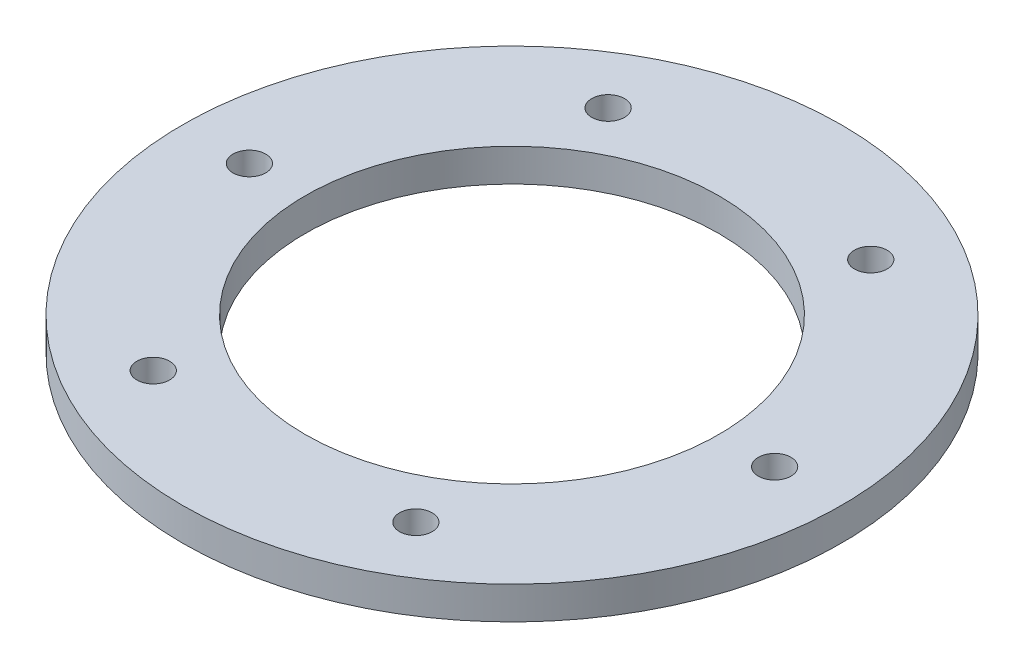
from build123d import *

# Parameters (mm, degrees)
SKETCH_1_W          = 15
SKETCH_1_H          = 4
SKETCH_2_R          = 2
CUT_EXTRUDE_1_DEPTH = 10


with BuildPart() as part:
    # 草图1 → 旋转1 (revolve)
    with BuildSketch(Plane.XY, mode=Mode.PRIVATE) as revolve_1_sk:
        with Locations((32.78, 2)):
            Rectangle(SKETCH_1_W, SKETCH_1_H)
    revolve(revolve_1_sk.sketch.rotate(Axis((0, 0, 0), (0, 1, 0)), 90), axis=Axis((0, 0, 0), (0, 1, 0)))

    # 草图2 → 切除-拉伸1 (cut)
    with BuildSketch(Plane(origin=(0, 4, 0), x_dir=(1, 0, 0), z_dir=(0, 1, 0))):
        with Locations(Location((-32.1, 0, 0), (0, 0, 270))):
            Circle(SKETCH_2_R)
        with Locations(Location((-16.05, 27.799415461, 0), (0, 0, 270))):
            Circle(SKETCH_2_R)
        with Locations(Location((16.05, 27.799415461, 0), (0, 0, 270))):
            Circle(SKETCH_2_R)
        with Locations(Location((32.1, 0, 0), (0, 0, 270))):
            Circle(SKETCH_2_R)
        with Locations(Location((16.05, -27.799415461, 0), (0, 0, 270))):
            Circle(SKETCH_2_R)
        with Locations(Location((-16.05, -27.799415461, 0), (0, 0, 270))):
            Circle(SKETCH_2_R)
    extrude(amount=-CUT_EXTRUDE_1_DEPTH, mode=Mode.SUBTRACT)


solid = part.part
